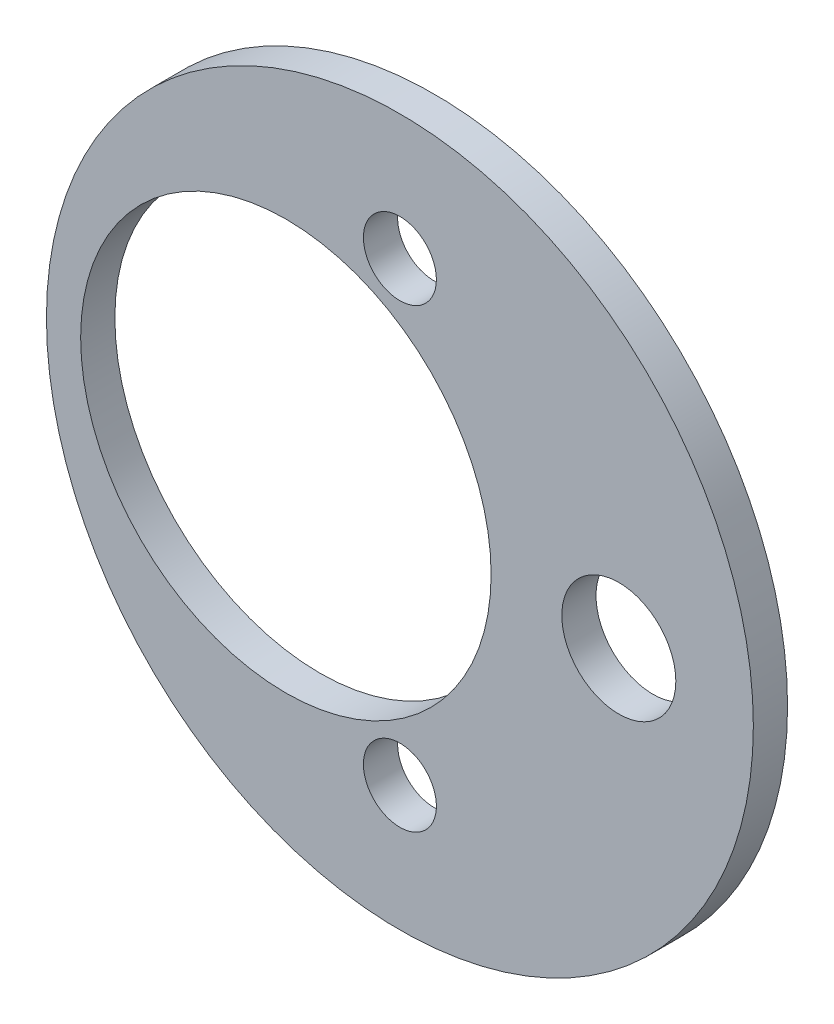
from build123d import *

# Parameters (mm, degrees)
SKETCH_1_R      = 15.5
SKETCH_1_R_2    = 9
SKETCH_1_R_3    = 2.5
SKETCH_1_R_4    = 1.6
EXTRUDE_1_DEPTH = 1.5


with BuildPart() as part:
    # Эскиз1 → Бобышка-Вытянуть1 (new body)
    with BuildSketch(Plane.XY):
        Circle(SKETCH_1_R)
        with Locations((-5, 0)):
            Circle(SKETCH_1_R_2, mode=Mode.SUBTRACT)
        with Locations((9.6, 0)):
            Circle(SKETCH_1_R_3, mode=Mode.SUBTRACT)
        with Locations((0, 10)):
            Circle(SKETCH_1_R_4, mode=Mode.SUBTRACT)
        with Locations(Location((0, -10, 0), (0, 0, 180))):
            Circle(SKETCH_1_R_4, mode=Mode.SUBTRACT)
    extrude(amount=EXTRUDE_1_DEPTH)


solid = part.part
